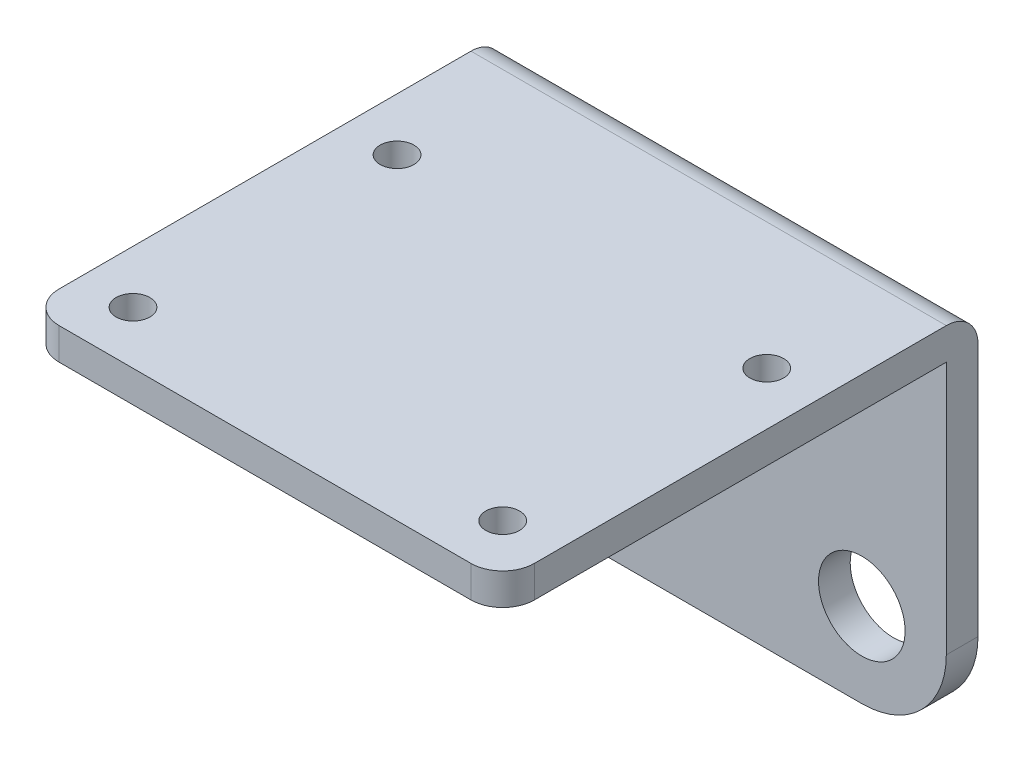
from build123d import *

# Parameters (mm, degrees)
SKETCH_1_W          = 45
SKETCH_1_H          = 45
SKETCH_1_R          = 1.6
EXTRUDE_1_DEPTH     = 3
SKETCH_2_W          = 45
SKETCH_2_H          = 3
EXTRUDE_2_DEPTH     = 32
CUT_EXTRUDE_1_REACH = 61.626
SKETCH_3_R          = 4.1
FILLET_1_R          = 3
FILLET_2_R          = 8


with BuildPart() as part:
    # 草图1 → 凸台-拉伸1 (new body)
    with BuildSketch(Plane(origin=(0, 0, 0), x_dir=(1, 0, 0), z_dir=(0, 1, 0))):
        Rectangle(SKETCH_1_W, SKETCH_1_H)
        with Locations(Location((-17.5, -17.5, 0), (0, 0, 270))):
            Circle(SKETCH_1_R, mode=Mode.SUBTRACT)
        with Locations(Location((17.5, -17.5, 0), (0, 0, 270))):
            Circle(SKETCH_1_R, mode=Mode.SUBTRACT)
        with Locations(Location((17.5, 7.5, 0), (0, 0, 270))):
            Circle(SKETCH_1_R, mode=Mode.SUBTRACT)
        with Locations(Location((-17.5, 7.5, 0), (0, 0, 270))):
            Circle(SKETCH_1_R, mode=Mode.SUBTRACT)
    extrude(amount=EXTRUDE_1_DEPTH)

    # 草图2 → 凸台-拉伸2 (add)
    with BuildSketch(Plane.XZ):
        with Locations((0, -21)):
            Rectangle(SKETCH_2_W, SKETCH_2_H)
    extrude(amount=EXTRUDE_2_DEPTH)

    # 草图3 → 切除-拉伸1 (cut, up to next)
    with BuildSketch(Plane(origin=(0, 0, -22.5), x_dir=(-1, 0, 0), z_dir=(0, 0, -1)), mode=Mode.PRIVATE) as cut_extrude_1_sk1:
        with Locations((-14.5, -24)):
            Circle(SKETCH_3_R)
    cut_extrude_1_tool1 = extrude(cut_extrude_1_sk1.sketch, amount=-CUT_EXTRUDE_1_REACH, mode=Mode.PRIVATE) & part.part
    # 草图3 → 切除-拉伸1 (cut, up to next)
    with BuildSketch(Plane(origin=(0, 0, -22.5), x_dir=(-1, 0, 0), z_dir=(0, 0, -1)), mode=Mode.PRIVATE) as cut_extrude_1_sk2:
        with Locations((14.5, -24)):
            Circle(SKETCH_3_R)
    cut_extrude_1_tool2 = extrude(cut_extrude_1_sk2.sketch, amount=-CUT_EXTRUDE_1_REACH, mode=Mode.PRIVATE) & part.part
    add(cut_extrude_1_tool1.solids().sort_by_distance((14.5, -24, -22.5))[0], mode=Mode.SUBTRACT)
    add(cut_extrude_1_tool2.solids().sort_by_distance((-14.5, -24, -22.5))[0], mode=Mode.SUBTRACT)

    # 圆角1
    fillet_1_edges = [part.edges().sort_by_distance(p)[0] for p in [
        (22.5, 1.5, 22.5),
        (-22.5, 1.5, 22.5),
        (0, 3, -22.5),
    ]]
    fillet(fillet_1_edges, radius=FILLET_1_R)

    # 圆角2
    fillet_2_edges = [part.edges().sort_by_distance(p)[0] for p in [
        (22.5, -32, -21),
        (-22.5, -32, -21),
    ]]
    fillet(fillet_2_edges, radius=FILLET_2_R)


solid = part.part
